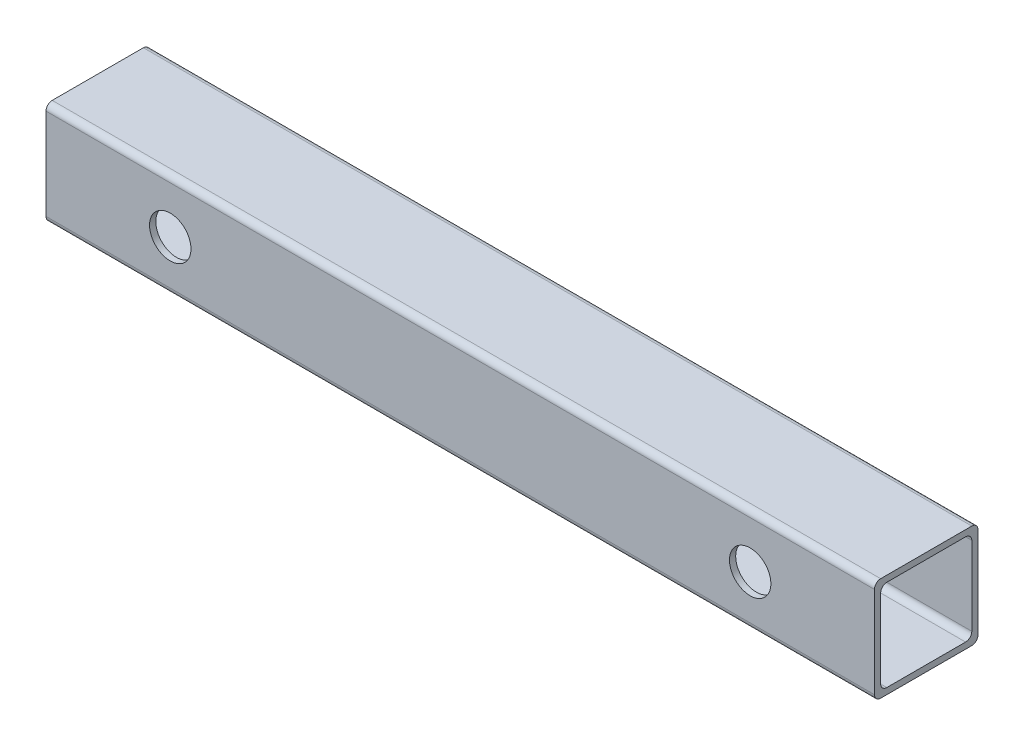
from build123d import *

# Parameters (mm, degrees)
BOSS_EXTRUDE1_DEPTH = 200
SKETCH3_R           = 5
CUT_EXTRUDE1_DEPTH  = 204.100960116


with BuildPart() as part:
    # Sketch1 → Boss-Extrude1 (new body)
    with BuildSketch(Plane(origin=(0, 0, 0), x_dir=(0, 0, -1), z_dir=(1, 0, 0))):
        with BuildLine():
            Line((1.5, 0), (23.5, 0))
            ThreePointArc((23.5, 0), (24.560660172, 0.439339828), (25, 1.5))
            Line((25, 1.5), (25, 23.5))
            ThreePointArc((25, 23.5), (24.560660172, 24.560660172), (23.5, 25))
            Line((23.5, 25), (1.5, 25))
            ThreePointArc((1.5, 25), (0.439339828, 24.560660172), (0, 23.5))
            Line((0, 23.5), (0, 1.5))
            ThreePointArc((0, 1.5), (0.439339828, 0.439339828), (1.5, 0))
        make_face()
        with BuildLine():
            Line((3, 23.5), (22, 23.5))
            ThreePointArc((22, 23.5), (23.060660172, 23.060660172), (23.5, 22))
            Line((23.5, 22), (23.5, 3))
            ThreePointArc((23.5, 3), (23.060660172, 1.939339828), (22, 1.5))
            Line((22, 1.5), (3, 1.5))
            ThreePointArc((3, 1.5), (1.939339828, 1.939339828), (1.5, 3))
            Line((1.5, 3), (1.5, 22))
            ThreePointArc((1.5, 22), (1.939339828, 23.060660172), (3, 23.5))
        make_face(mode=Mode.SUBTRACT)
    extrude(amount=BOSS_EXTRUDE1_DEPTH)

    # Sketch3 → Cut-Extrude1 (cut, through all)
    with BuildSketch(Plane(origin=(0, 0, -25), x_dir=(-1, 0, 0), z_dir=(0, 0, -1))):
        with Locations((-170, 12.176713796)):
            Circle(SKETCH3_R)
        with Locations((-30, 12.176713796)):
            Circle(SKETCH3_R)
    extrude(amount=-CUT_EXTRUDE1_DEPTH, mode=Mode.SUBTRACT)


solid = part.part
